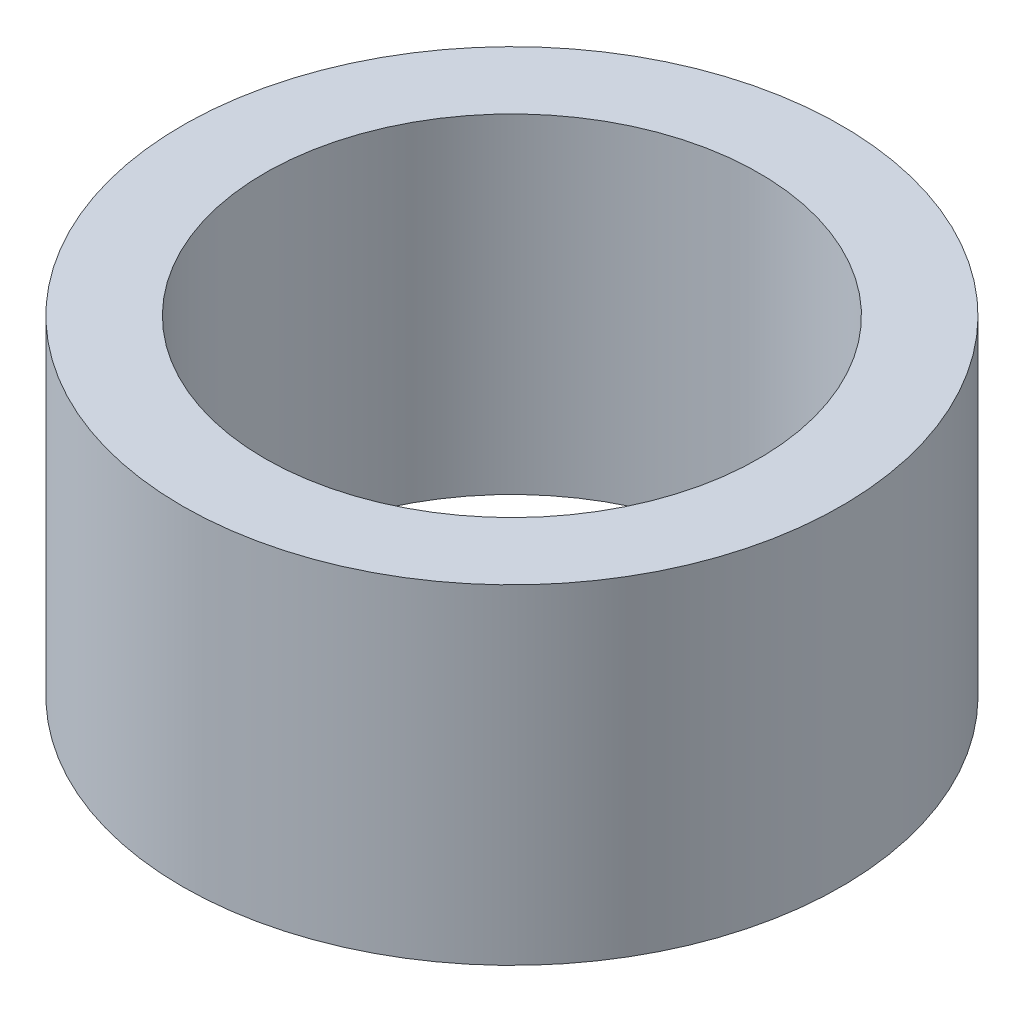
from build123d import *

# Parameters (mm, degrees)
SKETCH1_R           = 4
SKETCH1_R_2         = 3
BOSS_EXTRUDE1_DEPTH = 4


with BuildPart() as part:
    # Sketch1 → Boss-Extrude1 (new body)
    with BuildSketch(Plane(origin=(0, 0, 0), x_dir=(1, 0, 0), z_dir=(0, 1, 0))):
        with Locations(Location((0, 0, 0), (0, 0, 270))):
            Circle(SKETCH1_R)
        with Locations(Location((0, 0, 0), (0, 0, 270))):
            Circle(SKETCH1_R_2, mode=Mode.SUBTRACT)
    extrude(amount=BOSS_EXTRUDE1_DEPTH)


solid = part.part
